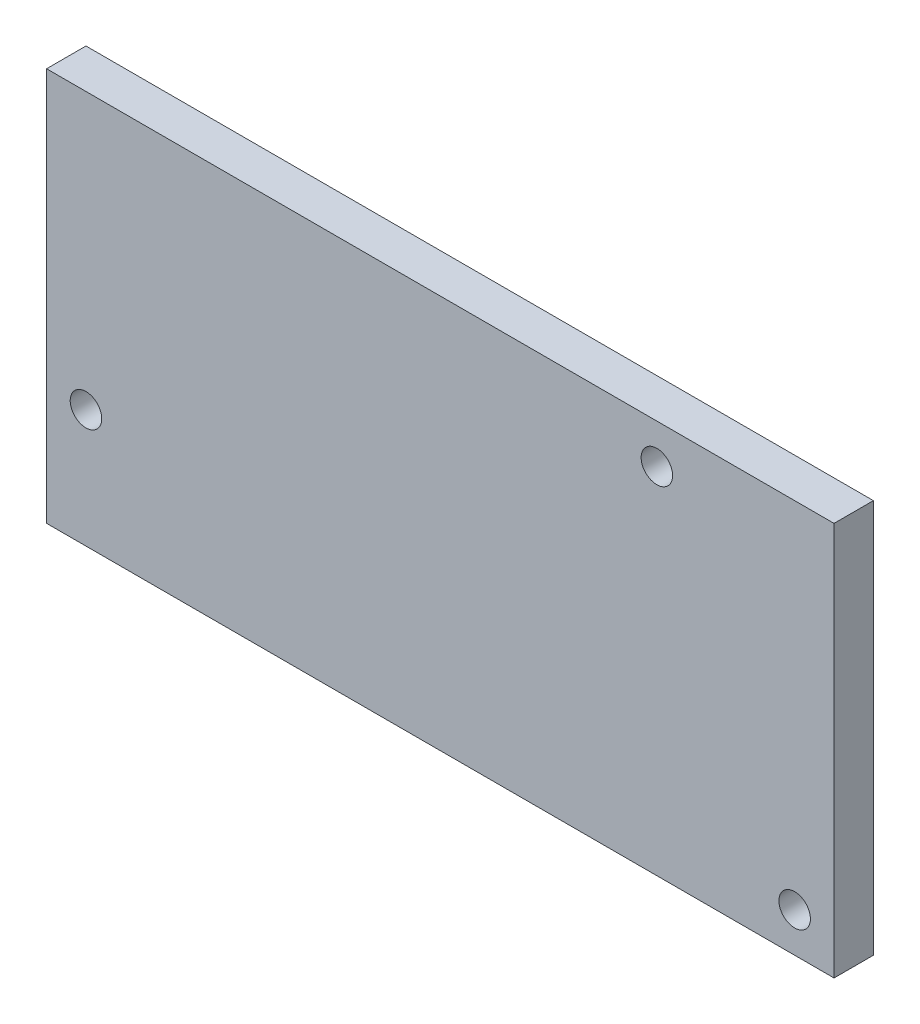
from build123d import *

# Parameters (mm, degrees)
SKETCH1_W           = 200
SKETCH1_H           = 100
SKETCH1_R           = 4
BOSS_EXTRUDE1_DEPTH = 10


with BuildPart() as part:
    # Sketch1 → Boss-Extrude1 (new body)
    with BuildSketch(Plane.XY):
        with Locations((100, 50)):
            Rectangle(SKETCH1_W, SKETCH1_H)
        with Locations((10, 30)):
            Circle(SKETCH1_R, mode=Mode.SUBTRACT)
        with Locations((190, 10)):
            Circle(SKETCH1_R, mode=Mode.SUBTRACT)
        with Locations((155, 90)):
            Circle(SKETCH1_R, mode=Mode.SUBTRACT)
    extrude(amount=BOSS_EXTRUDE1_DEPTH)


solid = part.part
